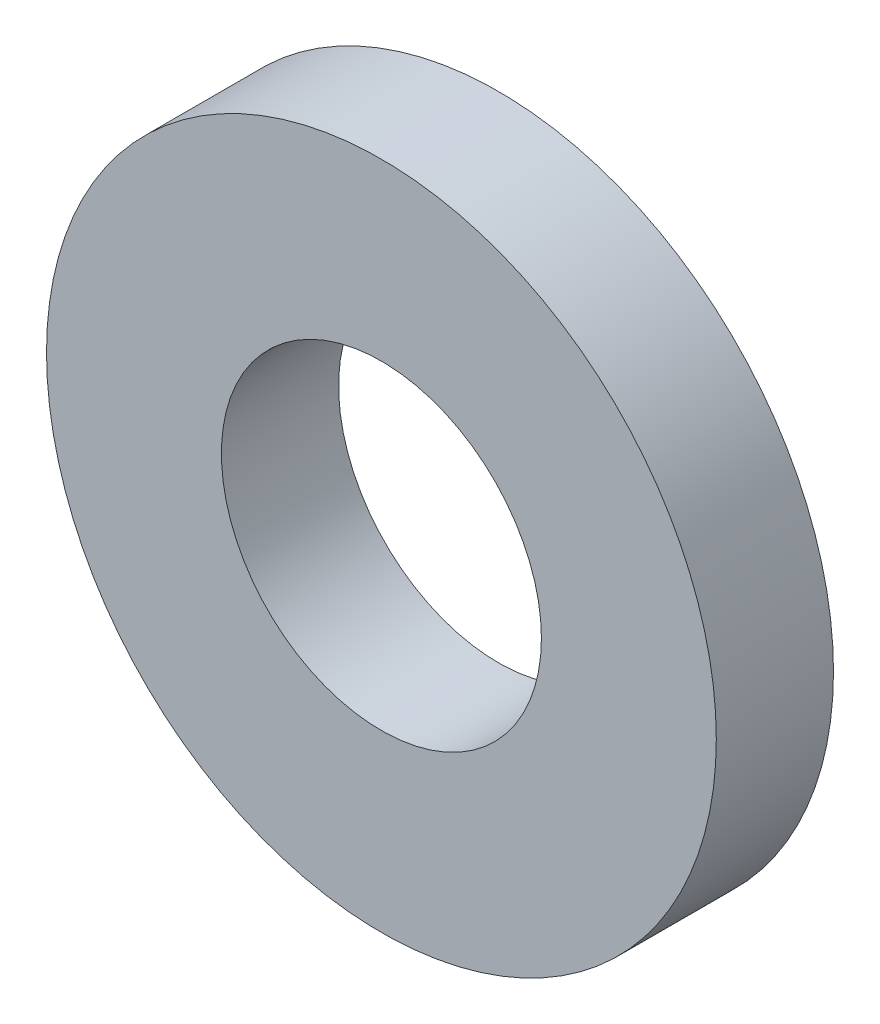
from build123d import *

# Parameters (mm, degrees)
BOSS_EXTRUDE3_DEPTH      = 0.78725
BOSS_EXTRUDE3_DEPTH_BACK = 0.78725
SKETCH3_R                = 4.5
SKETCH3_R_2              = 2.15


with BuildPart() as part:
    # Sketch3 → Boss-Extrude3 (new, two sides: drawn at the far end of the back side and taken through both)
    with BuildSketch(Plane.XY.offset(-BOSS_EXTRUDE3_DEPTH_BACK)):
        Circle(SKETCH3_R)
        Circle(SKETCH3_R_2, mode=Mode.SUBTRACT)
    extrude(amount=BOSS_EXTRUDE3_DEPTH + BOSS_EXTRUDE3_DEPTH_BACK)


solid = part.part
